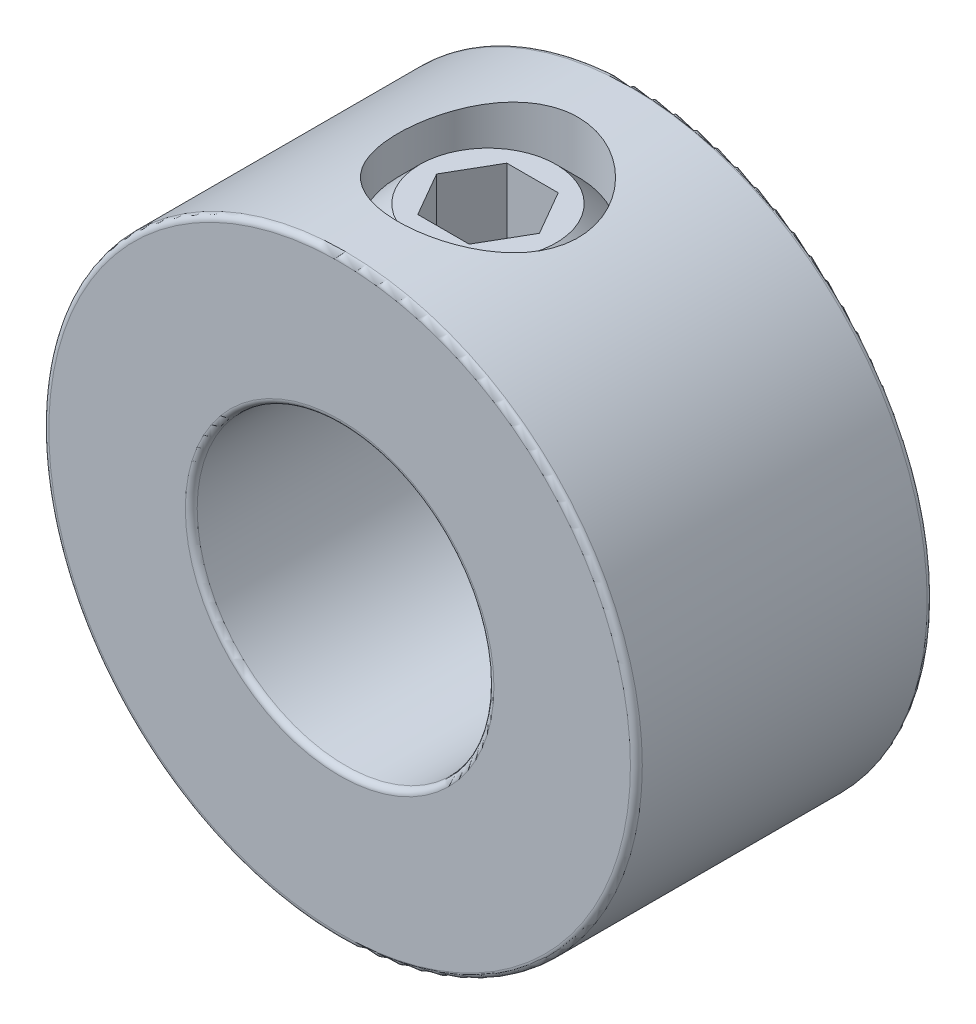
from build123d import *

# Parameters (mm, degrees)
SKETCH1_R          = 7.9375
SKETCH1_R_2        = 3.96875
EXTRUDE1_DEPTH     = 3.96875
SKETCH2_R          = 2.413
CUT_EXTRUDE1_DEPTH = 51.00625
FILLET1_R          = 0.15875
CUT_EXTRUDE2_DEPTH = 2.38125


with BuildPart() as part:
    # Sketch1 → Extrude1 (new, symmetric)
    with BuildSketch(Plane.XY):
        Circle(SKETCH1_R)
        Circle(SKETCH1_R_2, mode=Mode.SUBTRACT)
    extrude(amount=EXTRUDE1_DEPTH, both=True)

    # Sketch2 → Cut-Extrude1 (cut, through all)
    with BuildSketch(Plane(origin=(41.275, 0, 0), x_dir=(0, 0, -1), z_dir=(0, -1, 0))):
        with Locations((0, -41.275)):
            Circle(SKETCH2_R)
    extrude(amount=-CUT_EXTRUDE1_DEPTH, mode=Mode.SUBTRACT)

    # Fillet1
    fillet1_edges = [part.edges().sort_by_distance(p)[0] for p in [
        (-7.9375, 0, -3.96875),
        (-7.9375, 0, 3.96875),
        (-3.96875, 0, -3.96875),
        (-3.96875, 0, 3.96875),
    ]]
    fillet(fillet1_edges, radius=FILLET1_R)


with BuildPart() as body_2:
    # Sketch3 → Revolve1 (revolve)
    with BuildSketch(Plane.XY):
        Polygon((-1.819751616, 3.96875), (-0.71189806, 3.96875), (0, 4.68064806), (0, 7.14375), (-1.819751616, 7.14375), (-2.413, 6.550501616), (-2.413, 4.561998384), align=None)
    revolve(axis=Axis((0, 3.96875, 0), (0, -1, 0)))

    # Sketch4 → Cut-Extrude2 (cut)
    with BuildSketch(Plane(origin=(3.3734375, 7.14375, 0), x_dir=(0, 0, -1), z_dir=(0, -1, 0))):
        Polygon((0, -1.998622171), (-1.190625, -2.686029836), (-1.190625, -4.060845164), (0, -4.748252829), (1.190625, -4.060845164), (1.190625, -2.686029836), align=None)
    extrude(amount=CUT_EXTRUDE2_DEPTH, mode=Mode.SUBTRACT)


solid = Compound([part.part, body_2.part])
